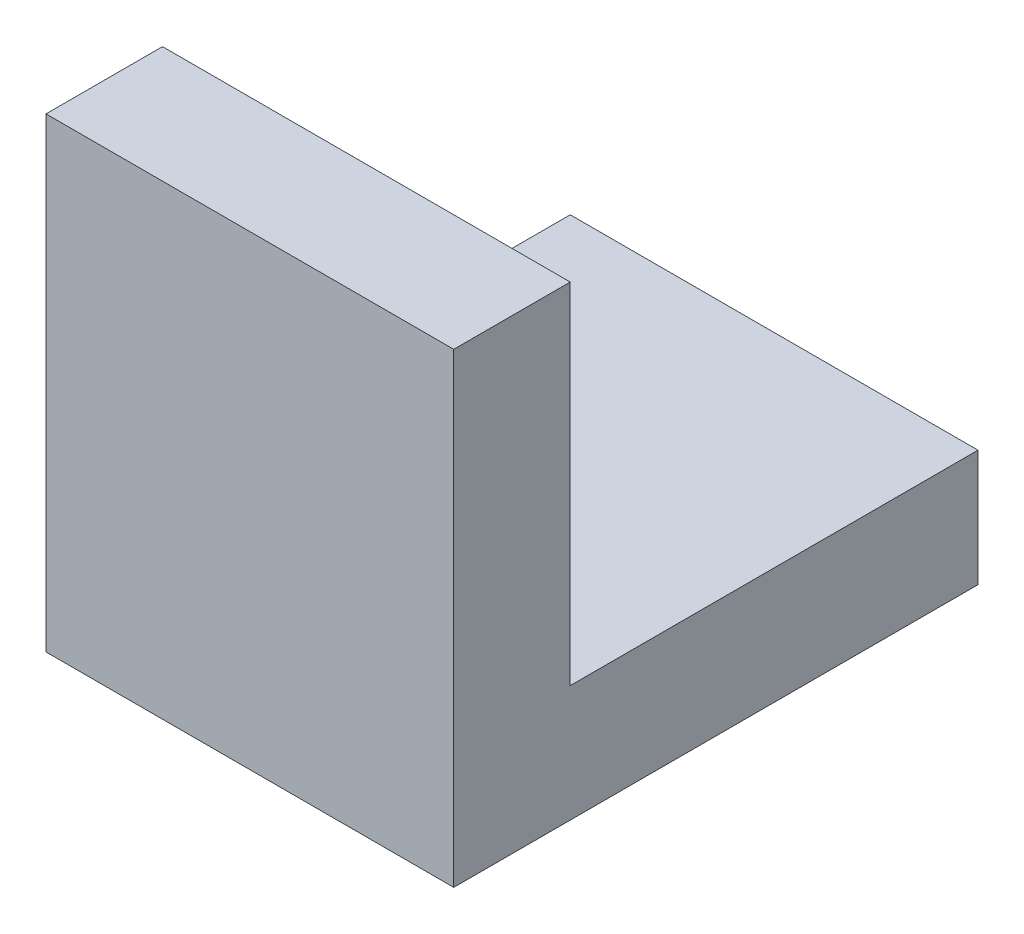
from build123d import *

# Parameters (mm, degrees)
BOSS_EXTRUDE2_DEPTH = 7000


with BuildPart() as part:
    # Sketch1 → Boss-Extrude2 (new body)
    with BuildSketch(Plane(origin=(0, 0, 0), x_dir=(0, 0, -1), z_dir=(1, 0, 0))):
        Polygon((0, 0), (0, 8000), (2000, 8000), (2000, 2000), (9000, 2000), (9000, 0), align=None)
    extrude(amount=BOSS_EXTRUDE2_DEPTH)


solid = part.part
